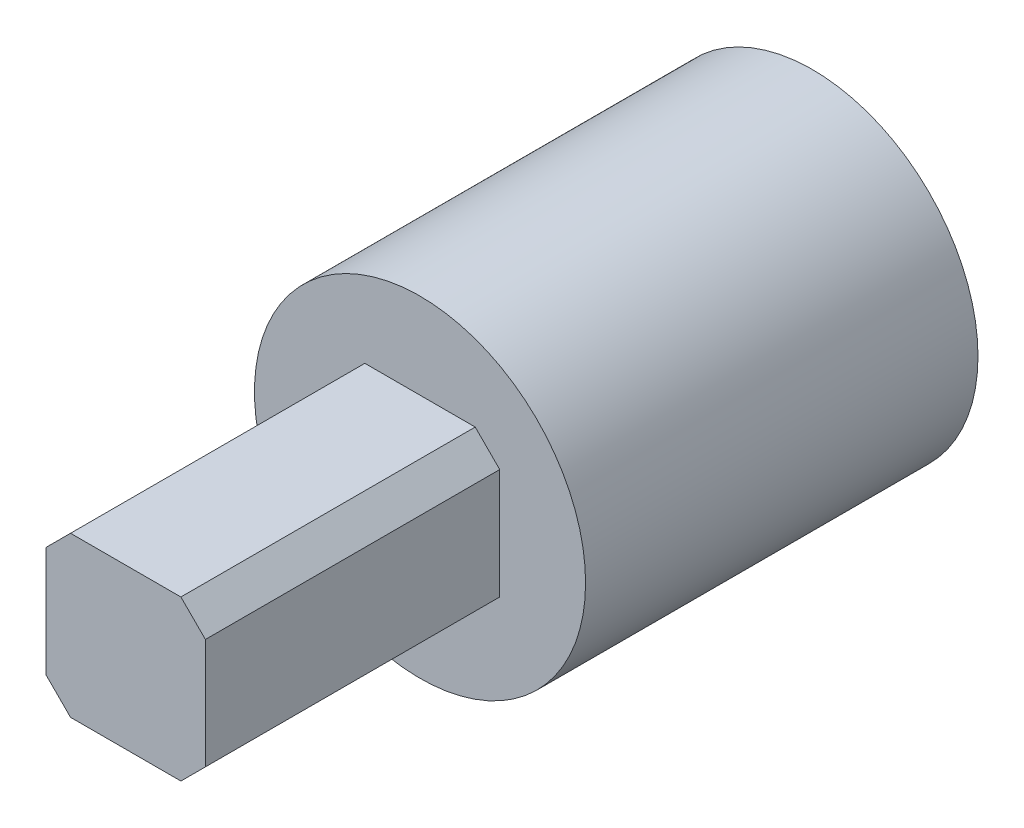
from build123d import *

# Parameters (mm, degrees)
SKETCH1_R           = 13.5
BOSS_EXTRUDE1_DEPTH = 32
BOSS_EXTRUDE2_DEPTH = 24


with BuildPart() as part:
    # Sketch1 → Boss-Extrude1 (new body)
    with BuildSketch(Plane.XY):
        Circle(SKETCH1_R)
    extrude(amount=BOSS_EXTRUDE1_DEPTH)

    # Sketch2 → Boss-Extrude2 (add)
    with BuildSketch(Plane.XY.offset(32)):
        Polygon((-6.5, 4.5), (-4.5, 6.5), (4.5, 6.5), (6.5, 4.5), (6.5, -4.5), (4.5, -6.5), (-4.5, -6.5), (-6.5, -4.5), align=None)
    extrude(amount=BOSS_EXTRUDE2_DEPTH)


solid = part.part
